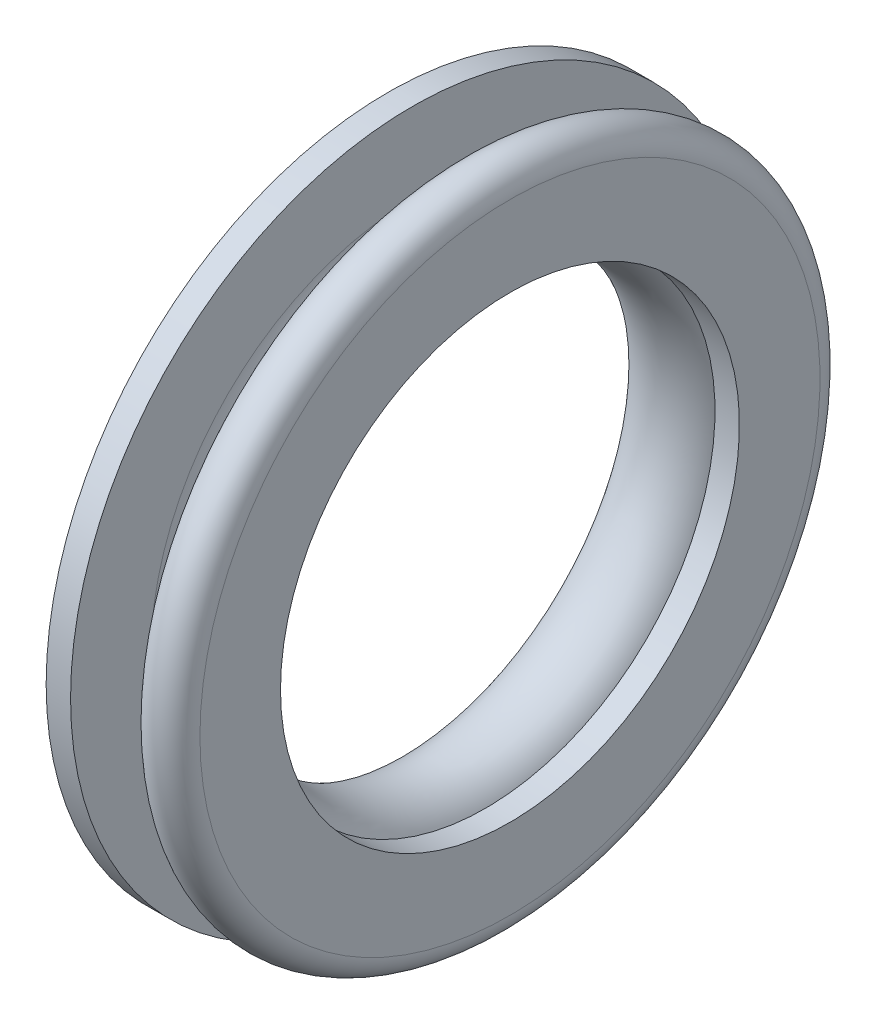
from build123d import *


with BuildPart() as part:
    # Sketch1 → Revolve1 (revolve)
    with BuildSketch(Plane.XY, mode=Mode.PRIVATE) as revolve1_sk:
        with BuildLine():
            Line((0.5, 1.65), (0, 1.65))
            Line((0, 1.65), (0, 0))
            ThreePointArc((0, 0), (1, -1), (2, 0))
            Line((2, 0), (2, -0.65))
            Line((2, -0.65), (2.5, -0.65))
            Line((2.5, -0.65), (2.5, 1))
            ThreePointArc((2.5, 1), (2, 1.5), (1.5, 1))
            Line((1.5, 1), (1.5, 0))
            ThreePointArc((1.5, 0), (1, -0.5), (0.5, 0))
            Line((0.5, 0), (0.5, 1.65))
        make_face()
    revolve(revolve1_sk.sketch.rotate(Axis((0, -5.35, 0), (1, 0, 0)), 90), axis=Axis((0, -5.35, 0), (1, 0, 0)))


solid = part.part
